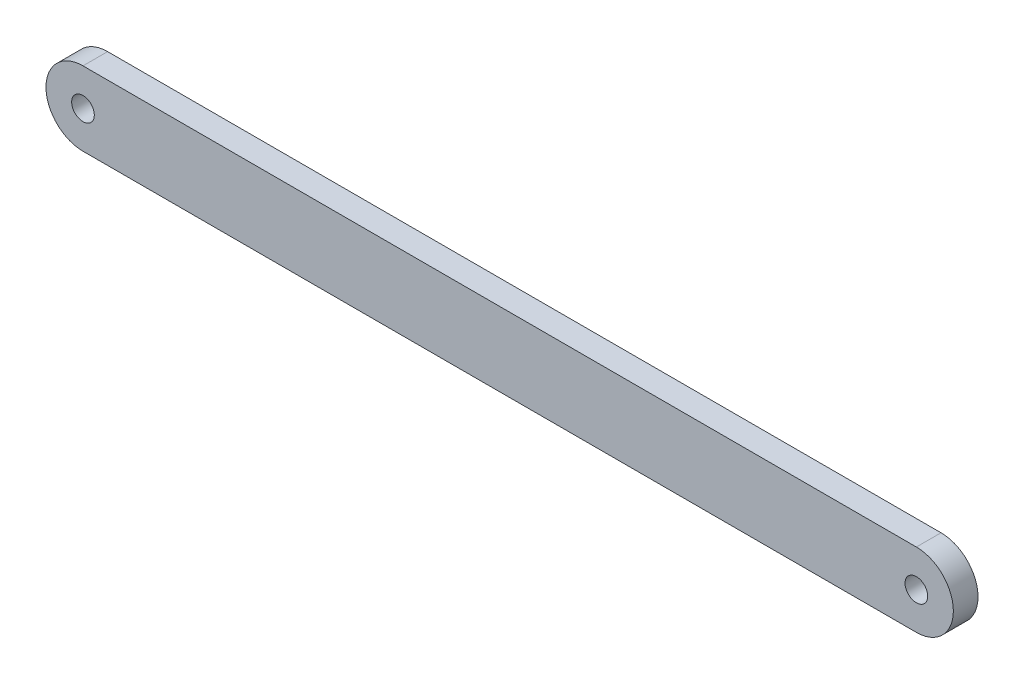
from build123d import *

# Parameters (mm, degrees)
SKETCH_1_R      = 2.3
EXTRUDE_1_DEPTH = 5


with BuildPart() as part:
    # 草图1 → 凸台-拉伸1 (new body)
    with BuildSketch(Plane.XY):
        with BuildLine():
            Line((-84.523369549, 7.5), (84.523369549, 7.5))
            ThreePointArc((84.523369549, 7.5), (92.023369549, 0), (84.523369549, -7.5))
            Line((84.523369549, -7.5), (-84.523369549, -7.5))
            ThreePointArc((-84.523369549, -7.5), (-92.023369549, 0), (-84.523369549, 7.5))
        make_face()
        with Locations((-84.523369549, 0)):
            Circle(SKETCH_1_R, mode=Mode.SUBTRACT)
        with Locations((84.523369549, 0)):
            Circle(SKETCH_1_R, mode=Mode.SUBTRACT)
    extrude(amount=EXTRUDE_1_DEPTH)


solid = part.part
